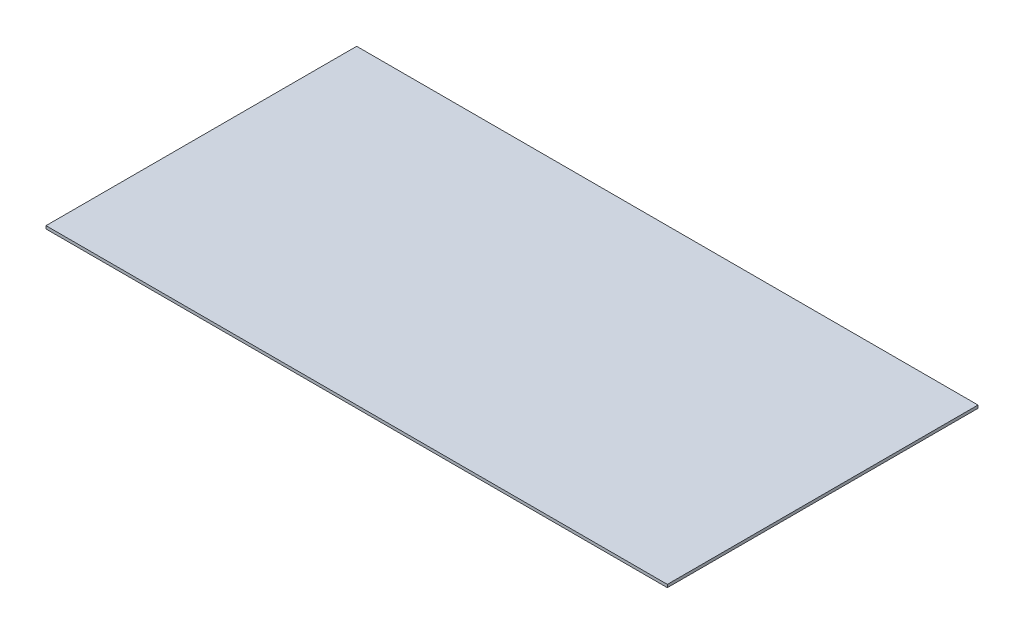
from build123d import *

# Parameters (mm, degrees)
SKETCH1_W           = 90
SKETCH1_H           = 45
BOSS_EXTRUDE1_DEPTH = 0.42


with BuildPart() as part:
    # Sketch1 → Boss-Extrude1 (new body)
    with BuildSketch(Plane(origin=(0, 0, 0), x_dir=(1, 0, 0), z_dir=(0, 1, 0))):
        Rectangle(SKETCH1_W, SKETCH1_H)
    extrude(amount=BOSS_EXTRUDE1_DEPTH)


solid = part.part
